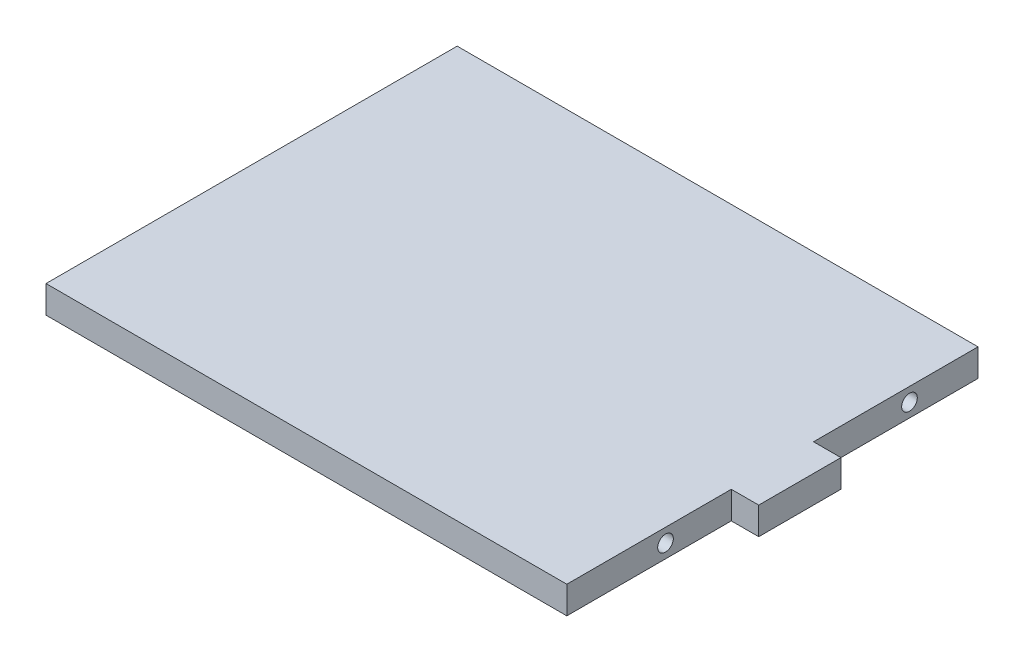
from build123d import *

# Parameters (mm, degrees)
SKETCH1_W           = 95
SKETCH1_H           = 75
BOSS_EXTRUDE1_DEPTH = 5
SKETCH3_W           = 15
SKETCH3_H           = 5
BOSS_EXTRUDE2_DEPTH = 5
SKETCH4_R           = 1.425
SKETCH4_R_2         = 1.422731811
CUT_EXTRUDE1_DEPTH  = 25
SKETCH5_R           = 1.425
CUT_EXTRUDE2_DEPTH  = 25
SKETCH6_R           = 1.425
CUT_EXTRUDE3_DEPTH  = 25


with BuildPart() as part:
    # Sketch1 → Boss-Extrude1 (new body)
    with BuildSketch(Plane(origin=(0, 0, 0), x_dir=(1, 0, 0), z_dir=(0, 1, 0))):
        Rectangle(SKETCH1_W, SKETCH1_H)
    extrude(amount=BOSS_EXTRUDE1_DEPTH)

    # Sketch3 → Boss-Extrude2 (add)
    with BuildSketch(Plane(origin=(47.5, 0, 0), x_dir=(0, 0, -1), z_dir=(1, 0, 0))):
        with Locations((0, 2.5)):
            Rectangle(SKETCH3_W, SKETCH3_H)
    extrude(amount=BOSS_EXTRUDE2_DEPTH)

    # Sketch4 → Cut-Extrude1 (cut)
    with BuildSketch(Plane.ZY.offset(47.5)):
        with Locations((-24, 2.5)):
            Circle(SKETCH4_R)
        with Locations((13, 2.5)):
            Circle(SKETCH4_R_2)
    extrude(amount=-CUT_EXTRUDE1_DEPTH, mode=Mode.SUBTRACT)

    # Sketch5 → Cut-Extrude2 (cut)
    with BuildSketch(Plane(origin=(47.5, 0, 0), x_dir=(0, 0, -1), z_dir=(1, 0, 0))):
        with Locations((-19.5, 2.5)):
            Circle(SKETCH5_R)
    extrude(amount=-CUT_EXTRUDE2_DEPTH, mode=Mode.SUBTRACT)

    # Sketch6 → Cut-Extrude3 (cut)
    with BuildSketch(Plane(origin=(47.5, 0, 0), x_dir=(0, 0, -1), z_dir=(1, 0, 0))):
        with Locations((25, 2.5)):
            Circle(SKETCH6_R)
    extrude(amount=-CUT_EXTRUDE3_DEPTH, mode=Mode.SUBTRACT)


solid = part.part
